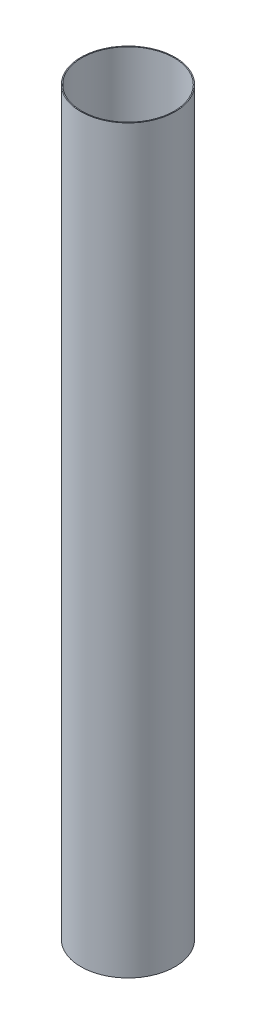
from build123d import *

# Parameters (mm, degrees)
SKETCH1_R           = 97.028
SKETCH1_R_2         = 95.123
BOSS_EXTRUDE1_DEPTH = 1524


with BuildPart() as part:
    # Sketch1 → Boss-Extrude1 (new body)
    with BuildSketch(Plane(origin=(0, 0, 0), x_dir=(1, 0, 0), z_dir=(0, 1, 0))):
        with Locations(Location((0, 0, 0), (0, 0, 270))):
            Circle(SKETCH1_R)
        with Locations(Location((0, 0, 0), (0, 0, 270))):
            Circle(SKETCH1_R_2, mode=Mode.SUBTRACT)
    extrude(amount=BOSS_EXTRUDE1_DEPTH)


solid = part.part
